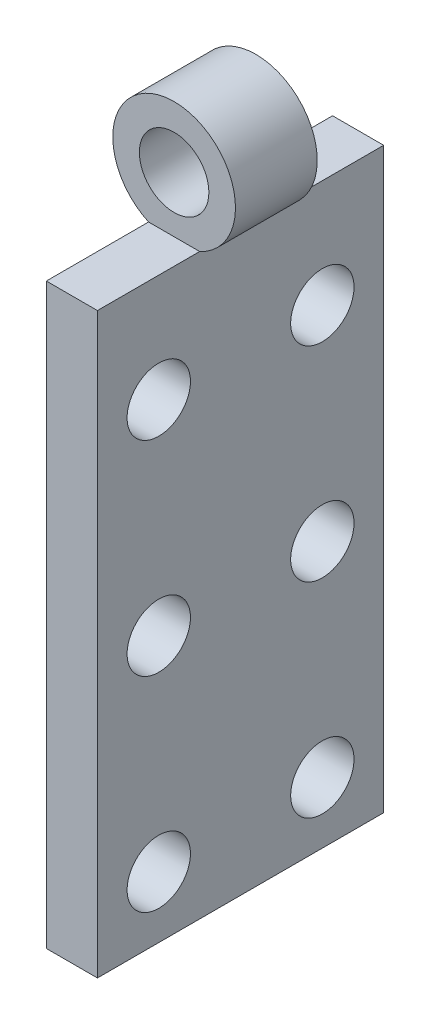
from build123d import *

# Parameters (mm, degrees)
SKETCH2_W           = 2.5
SKETCH2_H           = 28.272821971
BOSS_EXTRUDE5_DEPTH = 7
SKETCH2_8_R         = 3
BOSS_EXTRUDE6_DEPTH = 2
SKETCH3_R           = 1.7
CUT_EXTRUDE1_DEPTH  = 24.043437244
SKETCH4_R           = 1.55
CUT_EXTRUDE2_DEPTH  = 23.540241791


with BuildPart() as part:
    # Sketch2 → Boss-Extrude5 (new, symmetric)
    with BuildSketch(Plane.XY):
        with Locations((0, 1.136410986)):
            Rectangle(SKETCH2_W, SKETCH2_H)
    extrude(amount=BOSS_EXTRUDE5_DEPTH, both=True)

    # Sketch2<8> → Boss-Extrude6 (add, symmetric)
    with BuildSketch(Plane.XY):
        with Locations((0, 18)):
            Circle(SKETCH2_8_R)
    extrude(amount=BOSS_EXTRUDE6_DEPTH, both=True)

    # Sketch3 → Cut-Extrude1 (cut, through all)
    with BuildSketch(Plane.XY.offset(2)):
        with Locations((0, 18)):
            Circle(SKETCH3_R)
    extrude(amount=-CUT_EXTRUDE1_DEPTH, mode=Mode.SUBTRACT)

    # Sketch4 → Cut-Extrude2 (cut, through all)
    with BuildSketch(Plane(origin=(1.25, 0, 0), x_dir=(0, 0, -1), z_dir=(1, 0, 0))):
        with Locations((4, 0)):
            Circle(SKETCH4_R)
        with Locations((-4, 0)):
            Circle(SKETCH4_R)
        with Locations((-4, 10)):
            Circle(SKETCH4_R)
        with Locations((4, 10)):
            Circle(SKETCH4_R)
        with Locations((4, -10)):
            Circle(SKETCH4_R)
        with Locations((-4, -10)):
            Circle(SKETCH4_R)
    extrude(amount=-CUT_EXTRUDE2_DEPTH, mode=Mode.SUBTRACT)


solid = part.part
